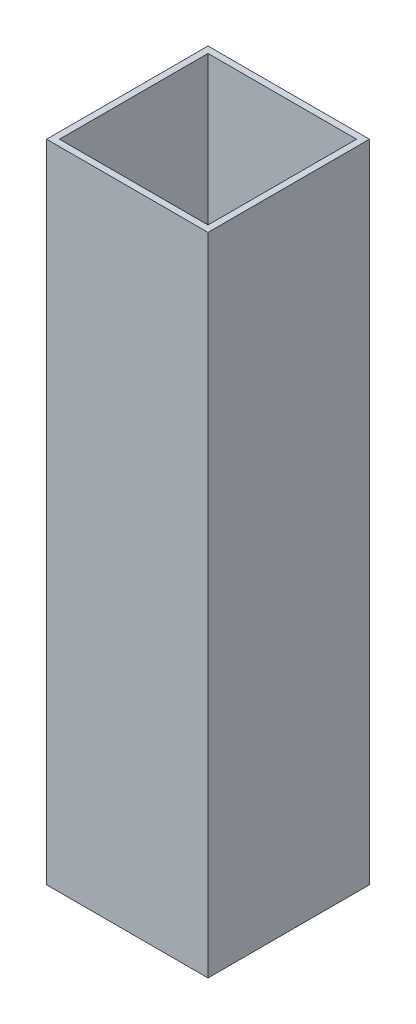
from build123d import *

# Parameters (mm, degrees)
SKETCH1_W           = 50
SKETCH1_H           = 50
SKETCH1_W_2         = 46
SKETCH1_H_2         = 46
BOSS_EXTRUDE1_DEPTH = 200


with BuildPart() as part:
    # Sketch1 → Boss-Extrude1 (new body)
    with BuildSketch(Plane(origin=(0, 0, 0), x_dir=(1, 0, 0), z_dir=(0, 1, 0))):
        Rectangle(SKETCH1_W, SKETCH1_H)
        Rectangle(SKETCH1_W_2, SKETCH1_H_2, mode=Mode.SUBTRACT)
    extrude(amount=BOSS_EXTRUDE1_DEPTH)


solid = part.part
